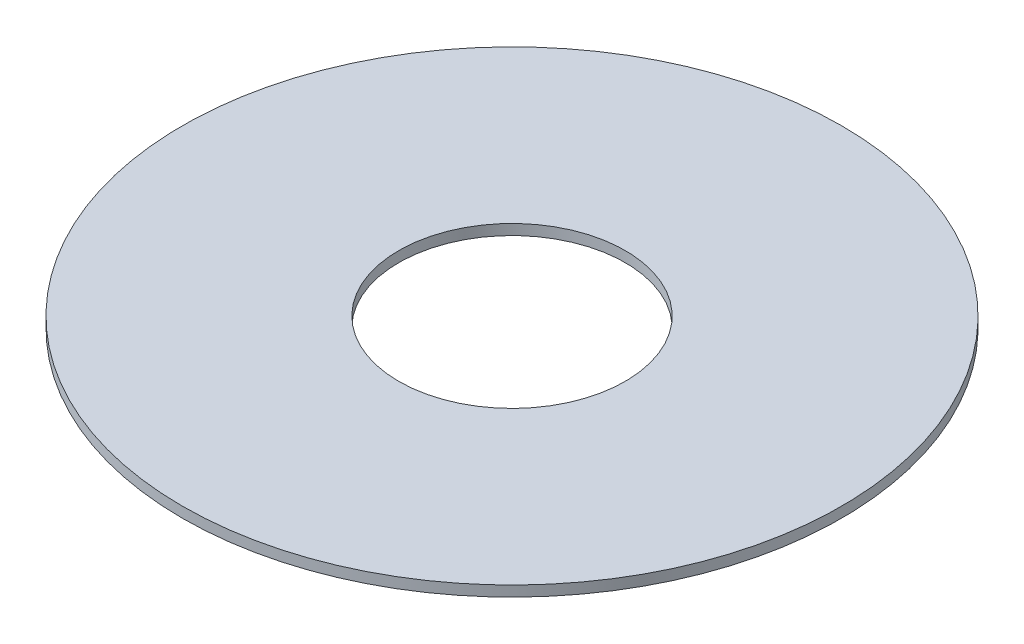
from build123d import *

# Parameters (mm, degrees)
SKETCH1_R           = 62.833006194
SKETCH1_R_2         = 21.6
BOSS_EXTRUDE1_DEPTH = 2


with BuildPart() as part:
    # Sketch1 → Boss-Extrude1 (new body)
    with BuildSketch(Plane(origin=(0, 0, 0), x_dir=(-1, 0, 0), z_dir=(0, 1, 0))):
        with Locations(Location((-29.458472739, -1.697654122, 0), (0, 0, 90))):
            Circle(SKETCH1_R)
        with Locations(Location((-29.458472739, -1.697654122, 0), (0, 0, 90))):
            Circle(SKETCH1_R_2, mode=Mode.SUBTRACT)
    extrude(amount=BOSS_EXTRUDE1_DEPTH)


solid = part.part
